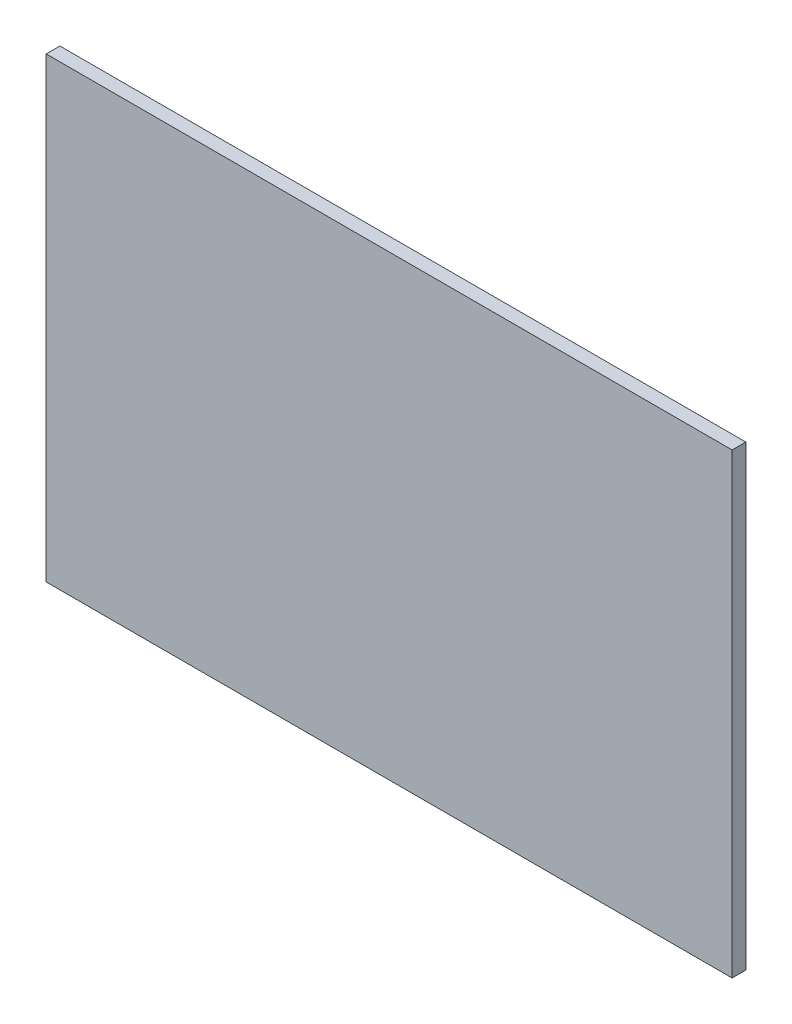
from build123d import *

# Parameters (mm, degrees)
ESQUISSE1_W        = 150
ESQUISSE1_H        = 100
BOSS_EXTRU_1_DEPTH = 3


with BuildPart() as part:
    # Esquisse1 → Boss.-Extru.1 (new body)
    with BuildSketch(Plane.XY):
        with Locations((0, -5.458015267)):
            Rectangle(ESQUISSE1_W, ESQUISSE1_H)
    extrude(amount=BOSS_EXTRU_1_DEPTH)


solid = part.part
